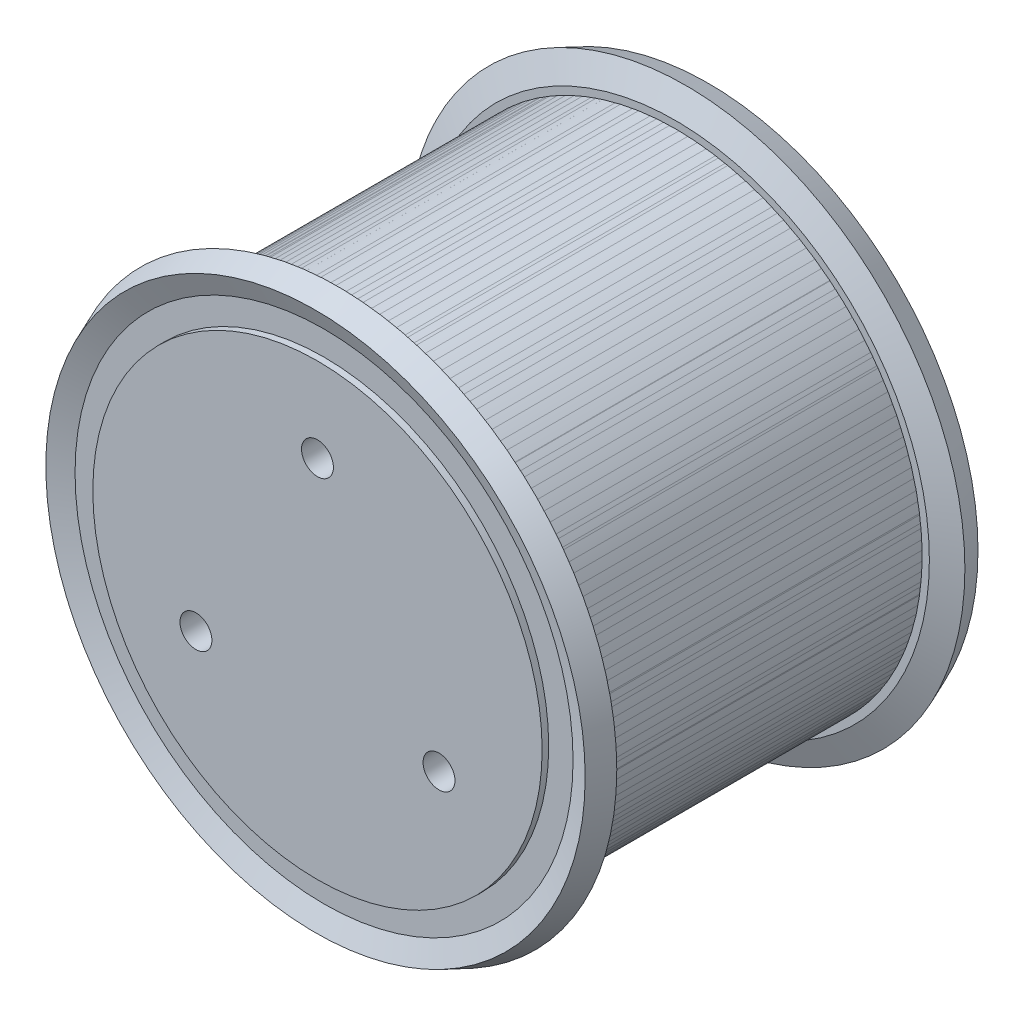
from build123d import *

# Parameters (mm, degrees)
TOOTHEXTRUDECUTGEARBELT01_DEPTH = 12.826999807
PATTERNGEARBELT01_COUNT         = 25
HOLE_WIZARD_M3_1_AT_2_COUNT     = 2
HOLE_WIZARD_M3_1_AT_2_PITCH     = 19.052558883
HOLE_WIZARD_M3_1_AT_3_COUNT     = 2
HOLE_WIZARD_M3_1_AT_3_PITCH     = 19.052558883


with BuildPart() as part:
    # SketchRevolveGearBelt01 → GearBelt01 (revolve)
    with BuildSketch(Plane(origin=(0, 0, 0), x_dir=(0, 0, -1), z_dir=(1, 0, 0))):
        Polygon((15.239999771, 0), (15.239999771, 17.608359236), (14.724379779, 17.608359236), (14.724379779, 19.516946859), (15.395329714, 21.136763292), (13.642379193, 21.862859172), (12.826999807, 19.894359201), (12.826999807, 19.32285921), (-12.826999807, 19.32285921), (-12.826999807, 19.894359201), (-13.642379193, 21.862859172), (-15.395329714, 21.136763292), (-14.724379779, 19.516946859), (-14.724379779, 17.608359236), (-15.239999771, 17.608359236), (-15.239999771, 0), align=None)
    revolve(axis=Axis((0, 0, 0), (0, 0, -1)))

    # SketchToothGearBelt01 → ToothExtrudeCutGearBelt01 (cut, symmetric)
    with BuildSketch(Plane.XY):
        with BuildLine():
            ThreePointArc((19.201886784, 2.154858722), (19.322418901, 0), (19.201886784, -2.154858722))
            add(Edge.make_bspline(
                [(19.201886784, -2.154858722), (19.205063733, -2.126576118), (19.206246153, -2.083751453), (19.200652549, -2.02705595), (19.192903305, -1.985036503), (19.181654331, -1.943815793), (19.166985123, -1.903684756), (19.148999188, -1.864926633), (19.127823477, -1.827814976), (19.103607443, -1.792611714), (19.076522002, -1.759565311), (19.046758321, -1.728909001), (19.014526469, -1.700859172), (18.980053935, -1.675613721), (18.943584023, -1.653351122), (18.905374142, -1.634227399), (18.865693941, -1.618381647), (18.824823604, -1.605910325), (18.783051126, -1.596958846), (18.740673063, -1.591376199), (18.673469638, -1.589211633), (18.587331767, -1.591072547), (18.482164565, -1.587323262), (18.383173161, -1.575292014), (18.285413052, -1.555722701), (18.189491505, -1.528503358), (18.095996939, -1.493863666), (18.005504868, -1.452000012), (17.918571792, -1.40317437), (17.835732469, -1.347685868), (17.757496435, -1.285876138), (17.684344924, -1.218125284), (17.616727879, -1.144850065), (17.555061256, -1.066501192), (17.499724206, -0.98356059), (17.451057708, -0.896538423), (17.409358862, -0.805969981), (17.374892554, -0.71241229), (17.347839444, -0.616441044), (17.32848291, -0.518645741), (17.316505457, -0.419630986), (17.313024785, -0.299855766), (17.314484247, -0.160003622), (17.313927737, 0), (17.314484247, 0.160003622), (17.313024785, 0.299855766), (17.316505457, 0.419630986), (17.32848291, 0.518645741), (17.347839444, 0.616441044), (17.374892554, 0.71241229), (17.409358862, 0.805969981), (17.451057708, 0.896538423), (17.499724206, 0.98356059), (17.555061256, 1.066501192), (17.616727879, 1.144850065), (17.684344924, 1.218125284), (17.757496435, 1.285876138), (17.835732469, 1.347685868), (17.918571792, 1.40317437), (18.005504868, 1.452000012), (18.095996939, 1.493863666), (18.189491505, 1.528503358), (18.285413052, 1.555722701), (18.383173161, 1.575292014), (18.482164565, 1.587323262), (18.587331767, 1.591072547), (18.673469638, 1.589211633), (18.740673063, 1.591376199), (18.783051126, 1.596958846), (18.824823604, 1.605910325), (18.865693941, 1.618381647), (18.905374142, 1.634227399), (18.943584023, 1.653351122), (18.980053935, 1.675613721), (19.014526469, 1.700859172), (19.046758321, 1.728909001), (19.076522002, 1.759565311), (19.103607443, 1.792611714), (19.127823477, 1.827814976), (19.148999188, 1.864926633), (19.166985123, 1.903684756), (19.181654331, 1.943815793), (19.192903305, 1.985036503), (19.200652549, 2.02705595), (19.206246153, 2.083751453), (19.205063733, 2.126576118), (19.201886784, 2.154858722)],
                knots=[0, 0, 0, 0, 0.013004275, 0.019506413, 0.026008551, 0.032510688, 0.039012826, 0.045514963, 0.052017101, 0.058519239, 0.065021376, 0.071523514, 0.078025652, 0.084527789, 0.091029927, 0.097532065, 0.104034202, 0.11053634, 0.117038478, 0.123540615, 0.130042753, 0.147745131, 0.162920208, 0.178095285, 0.193270362, 0.208445439, 0.223620516, 0.238795593, 0.25397067, 0.269145747, 0.284320824, 0.299495901, 0.314670978, 0.329846055, 0.345021132, 0.360196209, 0.375371287, 0.390546364, 0.405721441, 0.420896518, 0.436071595, 0.451246672, 0.475623336, 0.5, 0.524376664, 0.548753328, 0.563928405, 0.579103482, 0.594278559, 0.609453636, 0.624628713, 0.639803791, 0.654978868, 0.670153945, 0.685329022, 0.700504099, 0.715679176, 0.730854253, 0.74602933, 0.761204407, 0.776379484, 0.791554561, 0.806729638, 0.821904715, 0.837079792, 0.852254869, 0.869957247, 0.876459385, 0.882961522, 0.88946366, 0.895965798, 0.902467935, 0.908970073, 0.915472211, 0.921974348, 0.928476486, 0.934978624, 0.941480761, 0.947982899, 0.954485037, 0.960987174, 0.967489312, 0.973991449, 0.980493587, 0.986995725, 1, 1, 1, 1], degree=3))
        make_face()
    toothextrudecutgearbelt01 = extrude(amount=TOOTHEXTRUDECUTGEARBELT01_DEPTH, both=True, mode=Mode.SUBTRACT)

    # PatternGearBelt01: ToothExtrudeCutGearBelt01 ×25 about axis
    patterngearbelt01_axis = Axis((0, 0, 55), (0, 0, -1))
    for i in range(1, PATTERNGEARBELT01_COUNT):
        add(toothextrudecutgearbelt01.rotate(patterngearbelt01_axis, i * 360 / PATTERNGEARBELT01_COUNT), mode=Mode.SUBTRACT)

    # 草图6 → M3 螺纹孔1 (revolve, cut)
    with BuildSketch(Plane(origin=(9.526279442, -5.5, -15.239999771), x_dir=(0, 1, 0), z_dir=(1, 0, 0))):
        Polygon((0, 0), (0, 8.751075774), (1.25, 8), (1.25, 0), align=None)
    hole_wizard_m3_1 = revolve(axis=Axis((9.526279442, -5.5, -21.589999771), (0, 0, 1)), mode=Mode.SUBTRACT)

    # M3 螺纹孔1 at 2: M3 螺纹孔1 ×2
    with Locations(*[Vector(-0.49999999999996636, 0.8660254037844581, 0) * (i * HOLE_WIZARD_M3_1_AT_2_PITCH) for i in range(1, HOLE_WIZARD_M3_1_AT_2_COUNT)]):
        add(hole_wizard_m3_1, mode=Mode.SUBTRACT)

    # M3 螺纹孔1 at 3: M3 螺纹孔1 ×2
    with Locations(*[(-i * HOLE_WIZARD_M3_1_AT_3_PITCH, 0, 0) for i in range(1, HOLE_WIZARD_M3_1_AT_3_COUNT)]):
        add(hole_wizard_m3_1, mode=Mode.SUBTRACT)

    # 镜向1: M3 螺纹孔1 across plane
    add(hole_wizard_m3_1.mirror(Plane.XY), mode=Mode.SUBTRACT)

    # 镜向1 copy 1 sketch → 镜向1 copy 1 (revolve, cut)
    with BuildSketch(Plane(origin=(0, 11, 15.239999771), x_dir=(0, 1, 0), z_dir=(1, 0, 0))):
        Polygon((0, 0), (0, -8.751075774), (1.25, -8), (1.25, 0), align=None)
    revolve(axis=Axis((0, 11, 21.589999771), (0, 0, 1)), mode=Mode.SUBTRACT)

    # 镜向1 copy 2 sketch → 镜向1 copy 2 (revolve, cut)
    with BuildSketch(Plane(origin=(-9.526279442, -5.5, 15.239999771), x_dir=(0, 1, 0), z_dir=(1, 0, 0))):
        Polygon((0, 0), (0, -8.751075774), (1.25, -8), (1.25, 0), align=None)
    revolve(axis=Axis((-9.526279442, -5.5, 21.589999771), (0, 0, 1)), mode=Mode.SUBTRACT)


solid = part.part
